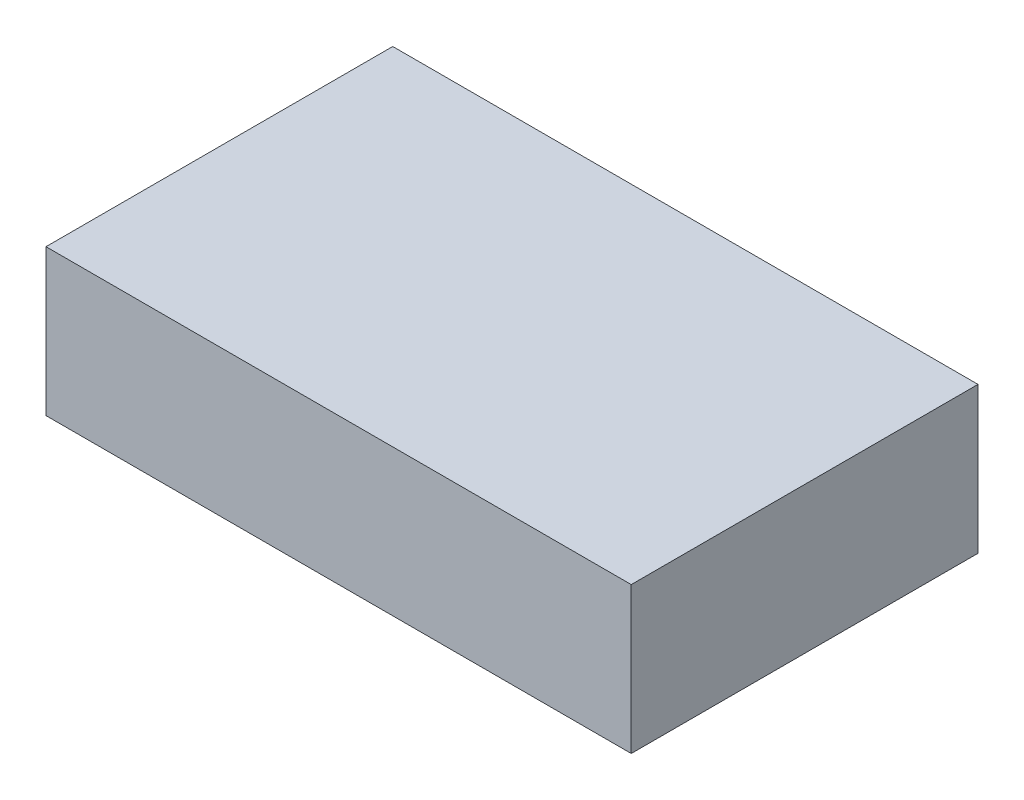
from build123d import *

# Parameters (mm, degrees)
SKETCH1_W           = 40
SKETCH1_H           = 23.7
BOSS_EXTRUDE1_DEPTH = 10


with BuildPart() as part:
    # Sketch1 → Boss-Extrude1 (new body)
    with BuildSketch(Plane(origin=(0, 0, 0), x_dir=(1, 0, 0), z_dir=(0, 1, 0))):
        with Locations((20, 11.85)):
            Rectangle(SKETCH1_W, SKETCH1_H)
    extrude(amount=BOSS_EXTRUDE1_DEPTH)


solid = part.part
